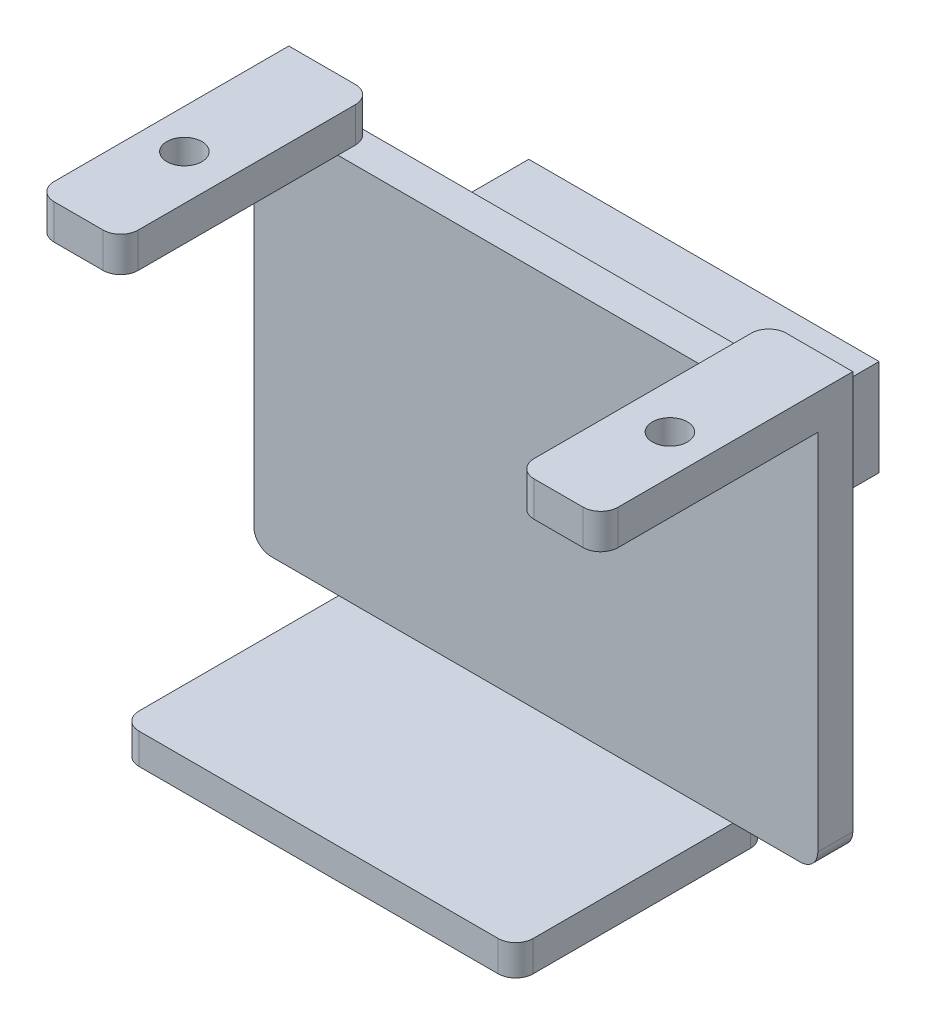
from build123d import *

# Parameters (mm, degrees)
SKETCH1_W           = 32.2
SKETCH1_H           = 25.5
BOSS_EXTRUDE1_DEPTH = 14.4
SKETCH3_W           = 32.2
SKETCH3_H           = 21.75
CUT_EXTRUDE1_DEPTH  = 12.4
SKETCH5_W           = 22.6
SKETCH5_H           = 2
CUT_EXTRUDE2_DEPTH  = 14.4
FILLET1_R           = 1
FILLET2_R           = 1
FILLET3_R           = 1
FILLET4_R           = 1
SKETCH10_R          = 1
CUT_EXTRUDE3_DEPTH  = 10
SKETCH11_W          = 4.85
SKETCH11_H          = 1.75
CUT_EXTRUDE4_DEPTH  = 20
FILLET5_R           = 1
FILLET6_R           = 1
SKETCH12_W          = 20
SKETCH12_H          = 2
BOSS_EXTRUDE2_DEPTH = 5
BOSS_EXTRUDE3_DEPTH = 5


with BuildPart() as part:
    # Sketch1 → Boss-Extrude1 (new body)
    with BuildSketch(Plane.XY):
        Rectangle(SKETCH1_W, SKETCH1_H)
    extrude(amount=BOSS_EXTRUDE1_DEPTH)

    # Sketch3 → Cut-Extrude1 (cut)
    with BuildSketch(Plane.XY.offset(14.4)):
        with Locations((0, -0.125)):
            Rectangle(SKETCH3_W, SKETCH3_H)
    extrude(amount=-CUT_EXTRUDE1_DEPTH, mode=Mode.SUBTRACT)

    # Sketch5 → Cut-Extrude2 (cut)
    with BuildSketch(Plane.XY.offset(14.4)):
        with Locations((0, 11.75)):
            Rectangle(SKETCH5_W, SKETCH5_H)
    extrude(amount=-CUT_EXTRUDE2_DEPTH, mode=Mode.SUBTRACT)

    # Fillet1
    fillet1_edges = [part.edges().sort_by_distance(p)[0] for p in [
        (-11.3, 11.75, 14.4),
    ]]
    fillet(fillet1_edges, radius=FILLET1_R)

    # Fillet2
    fillet2_edges = [part.edges().sort_by_distance(p)[0] for p in [
        (-16.1, 11.75, 14.4),
    ]]
    fillet(fillet2_edges, radius=FILLET2_R)

    # Fillet3
    fillet3_edges = [part.edges().sort_by_distance(p)[0] for p in [
        (11.3, 11.75, 14.4),
    ]]
    fillet(fillet3_edges, radius=FILLET3_R)

    # Fillet4
    fillet4_edges = [part.edges().sort_by_distance(p)[0] for p in [
        (16.1, 11.75, 14.4),
    ]]
    fillet(fillet4_edges, radius=FILLET4_R)

    # Sketch10 → Cut-Extrude3 (cut)
    with BuildSketch(Plane(origin=(0, 12.75, 0), x_dir=(1, 0, 0), z_dir=(0, 1, 0))):
        with Locations(Location((-13.86, -8.203047487, 0), (0, 0, 270))):
            Circle(SKETCH10_R)
    cut_extrude3 = extrude(amount=-CUT_EXTRUDE3_DEPTH, mode=Mode.SUBTRACT)

    # Mirror1: Cut-Extrude3 across plane
    add(cut_extrude3.mirror(Plane(origin=(0, 0, 0), x_dir=(0, 0, 1), z_dir=(1, 0, 0))), mode=Mode.SUBTRACT)

    # Sketch11 → Cut-Extrude4 (cut)
    with BuildSketch(Plane.XY.offset(14.4)):
        with Locations((-13.675, -11.875)):
            Rectangle(SKETCH11_W, SKETCH11_H)
    cut_extrude4 = extrude(amount=-CUT_EXTRUDE4_DEPTH, mode=Mode.SUBTRACT)

    # Mirror2: Cut-Extrude4 across plane
    add(cut_extrude4.mirror(Plane(origin=(0, 0, 0), x_dir=(0, 0, 1), z_dir=(1, 0, 0))), mode=Mode.SUBTRACT)

    # Fillet5
    fillet5_edges = [part.edges().sort_by_distance(p)[0] for p in [
        (16.1, -11, 1),
        (11.25, -11.875, 14.4),
        (11.25, -11.875, 0),
        (-11.25, -11.875, 0),
        (-16.1, -11, 1),
        (-11.25, -11.875, 14.4),
    ]]
    fillet(fillet5_edges, radius=FILLET5_R)

    # Fillet6
    fillet6_edges = [part.edges().sort_by_distance(p)[0] for p in [
        (-11.3, 11.75, 0),
        (11.3, 11.75, 0),
    ]]
    fillet(fillet6_edges, radius=FILLET6_R)

    # Sketch12 → Boss-Extrude2 (add)
    with BuildSketch(Plane(origin=(0, 0, 0), x_dir=(-1, 0, 0), z_dir=(0, 0, -1))):
        with Locations((-2.6, 4.5)):
            Rectangle(SKETCH12_W, SKETCH12_H)
    extrude(amount=BOSS_EXTRUDE2_DEPTH)

    # Sketch13 → Boss-Extrude3 (add)
    with BuildSketch(Plane(origin=(0, 0, 0), x_dir=(-1, 0, 0), z_dir=(0, 0, -1))):
        Polygon((-12.6, 9), (7.4, 9), (7.4, 7), (7.4, 5.5), (6.4, 5.5), (6.4, 7), (-11.6, 7), (-11.6, 5.5), (-12.6, 5.5), (-12.6, 7), align=None)
    extrude(amount=BOSS_EXTRUDE3_DEPTH)


solid = part.part
